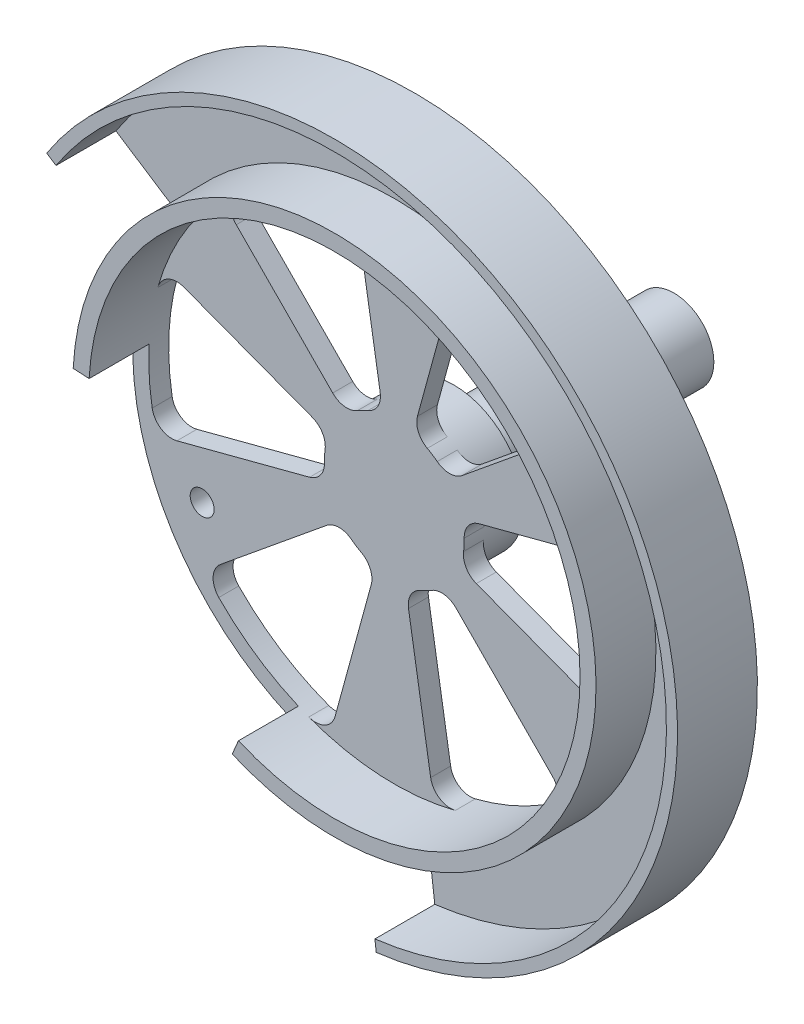
from build123d import *

# Parameters (mm, degrees)
SCHIZZO1_R                   = 10.000000000000002
ESTRUSIONE_ESTRUSIONE1_DEPTH = 55
SCHIZZO2_R                   = 17.500000000000004
ESTRUSIONE_ESTRUSIONE2_DEPTH = 10
SCHIZZO3_R                   = 85.905
ESTRUSIONE_ESTRUSIONE3_DEPTH = 5
ESTRUSIONE_ESTRUSIONE4_DEPTH = 15
TAGLIO_ESTRUSIONE1_DEPTH     = 141.2117614538809
ESTRUSIONE_ESTRUSIONE5_START = 15
SCHIZZO6_R                   = 65.50000000000003
SCHIZZO6_R_2                 = 61.50000000000001
ESTRUSIONE_ESTRUSIONE5_DEPTH = 15
TAGLIO_ESTRUSIONE2_DEPTH     = 141.2117614538809
TAGLIO_ESTRUSIONE3_DEPTH     = 15
SCHIZZO9_R                   = 3.0000000000000018
TAGLIO_ESTRUSIONE4_DEPTH     = 141.2117614538809


with BuildPart() as part:
    # Schizzo1 → Estrusione-Estrusione1 (new body)
    with BuildSketch(Plane.XY):
        Circle(SCHIZZO1_R)
    extrude(amount=ESTRUSIONE_ESTRUSIONE1_DEPTH)

    # Schizzo2 → Estrusione-Estrusione2 (add)
    with BuildSketch(Plane.XY.offset(55)):
        Circle(SCHIZZO2_R)
    extrude(amount=ESTRUSIONE_ESTRUSIONE2_DEPTH)

    # Schizzo3 → Estrusione-Estrusione3 (add)
    with BuildSketch(Plane.XY.offset(65)):
        Circle(SCHIZZO3_R)
    extrude(amount=ESTRUSIONE_ESTRUSIONE3_DEPTH)

    # Schizzo4 → Estrusione-Estrusione4 (add)
    with BuildSketch(Plane.XY.offset(70)):
        with BuildLine():
            ThreePointArc((2.33238e-12, 85.905), (-40.99032330010046, 75.49478406322679), (-72.04599513935142, 46.78721630296627))
            Line((-72.0459951393514, 46.78721630296625), (-69.71449096046315, 45.27311978562447))
            ThreePointArc((-69.71449096046314, 45.27311978562449), (-39.66382194658025, 73.05167249002571), (-1.12081e-12, 83.125))
            Line((0, 83.125), (0, 85.905))
        make_face()
        with BuildLine():
            Line((10.130389170552856, -82.5053988551849), (10.469185945219174, -85.26467715674777))
            ThreePointArc((10.469185945219136, -85.26467715674778), (64.3390411943792, -56.92237524197296), (85.905, -2.104e-14))
            ThreePointArc((85.905, 0), (60.74400803783119, 60.74400803782954), (2.33238e-12, 85.905))
            Line((0, 85.905), (0, 83.125))
            ThreePointArc((-1.10236e-12, 83.125), (58.77825118613137, 58.77825118613215), (83.125, 0))
            ThreePointArc((83.125, -2.036e-14), (62.25694429058578, -55.08029150793321), (10.130389170552828, -82.5053988551849))
        make_face()
    extrude(amount=ESTRUSIONE_ESTRUSIONE4_DEPTH)

    # Schizzo5 → Taglio-Estrusione1 (cut, through all)
    with BuildSketch(Plane.XY.offset(70)):
        with BuildLine():
            Line((-69.7144909604632, 45.27311978562441), (-72.04599513935146, 46.78721630296619))
            ThreePointArc((-72.04599513935142, 46.787216302966286), (-72.85157170031785, -45.522714393953365), (10.469185945219396, -85.26467715674775))
            Line((10.469185945218987, -85.26467715674781), (10.130389170552684, -82.50539885518494))
            Line((10.130389170552684, -82.50539885518494), (7.982441993037, -65.0117729325066))
            ThreePointArc((7.9824419930370025, -65.01177293250663), (-55.54715029824602, -34.70971180727477), (-54.932922200425146, 35.67385679348449))
            Line((-54.93292220042516, 35.67385679348449), (-69.7144909604632, 45.27311978562441))
        make_face()
    extrude(amount=-TAGLIO_ESTRUSIONE1_DEPTH, mode=Mode.SUBTRACT)

    # Schizzo6 → Estrusione-Estrusione5 (add)
    with BuildSketch(Plane.XY.offset(70).offset(ESTRUSIONE_ESTRUSIONE5_START)):
        Circle(SCHIZZO6_R)
        Circle(SCHIZZO6_R_2, mode=Mode.SUBTRACT)
    extrude(amount=-ESTRUSIONE_ESTRUSIONE5_DEPTH)

    # Schizzo7 → Taglio-Estrusione2 (cut, through all)
    with BuildSketch(Plane.XY.offset(70)):
        with BuildLine():
            Line((-9.094792559402517, 55.53858792138523), (-3.5451694376210634, 21.649059417410207))
            ThreePointArc((-3.5451694376210634, 21.649059417410207), (-4.118256573097941, 18.39563458554113), (-6.595126237509526, 16.209698020361557))
            ThreePointArc((-6.595126237509526, 16.209698020361557), (-7.944833745441985, 15.59261417329648), (-9.237403232743027, 14.863390646676436))
            ThreePointArc((-9.237403232743027, 14.863390646676436), (-12.461730523190647, 14.144422270775147), (-15.430658668606016, 15.59310017453149))
            Line((-15.430658668606016, 15.59310017453149), (-39.58587653291128, 40.00260465421101))
            ThreePointArc((-39.58587653291128, 40.00260465421101), (-41.025744459915046, 43.76718552220088), (-39.2205410364265, 47.37086827164967))
            ThreePointArc((-39.2205410364265, 47.37086827164967), (-27.92041573398183, 54.796901237584784), (-15.27058186191767, 59.57398198541434))
            ThreePointArc((-15.27058186191767, 59.57398198541434), (-11.294069325563324, 58.91623065925357), (-9.094792559402517, 55.53858792138523))
        make_face()
        with BuildLine():
            Line((43.550431750534024, 35.64561535928479), (16.976050704705482, 13.894736502405099))
            ThreePointArc((16.976050704705482, 13.894736502405099), (13.871958583265304, 12.764332104375594), (10.740447154552704, 13.816395873029286))
            ThreePointArc((10.740447154552704, 13.816395873029286), (9.53118311276309, 14.676734939044845), (8.253372270022329, 15.431521187894159))
            ThreePointArc((8.253372270022329, 15.431521187894159), (6.018563746750371, 17.864386343586606), (5.788691540596875, 21.159892491405103))
            Line((5.788691540596875, 21.159892491405103), (14.850333581636846, 54.28367703568089))
            ThreePointArc((14.850333581636846, 54.28367703568089), (17.390622284415066, 57.41292967255552), (21.41410480436174, 57.65141902354019))
            ThreePointArc((21.41410480436174, 57.65141902354019), (33.495300653424565, 51.578239928643306), (43.95729087300659, 43.011702815697646))
            ThreePointArc((43.95729087300659, 43.011702815697646), (45.37591778335563, 39.239066277667106), (43.550431750534024, 35.64561535928479))
        make_face()
        with BuildLine():
            Line((52.645224309936374, -19.89297256210059), (20.52122014232648, -7.754322915005166))
            ThreePointArc((20.52122014232648, -7.754322915005166), (17.990215156363192, -5.631302481165585), (17.335573392062187, -2.3933021473323244))
            ThreePointArc((17.335573392062187, -2.3933021473323244), (17.476016858205035, -0.9158792342516949), (17.49077550276533, 0.5681305412176627))
            ThreePointArc((17.49077550276533, 0.5681305412176627), (18.480294269940998, 3.7199640728113863), (21.21935020920287, 5.566792316873533))
            Line((21.21935020920287, 5.566792316873533), (54.436210114548075, 14.281072381469665))
            ThreePointArc((54.436210114548075, 14.281072381469665), (58.416366744330055, 13.64574415035441), (60.634645840788174, 10.280550751890294))
            ThreePointArc((60.634645840788174, 10.280550751890294), (61.41571638740626, -3.2186613089416714), (59.2278727349241, -16.562279169716877))
            ThreePointArc((59.2278727349241, -16.562279169716877), (56.66998710891878, -19.67716438158663), (52.645224309936374, -19.89297256210059))
        make_face()
        with BuildLine():
            Line((9.094792559402126, -55.538587921385286), (3.54516943762091, -21.649059417410225))
            ThreePointArc((3.54516943762091, -21.649059417410225), (4.118256573097811, -18.395634585541153), (6.595126237509411, -16.209698020361596))
            ThreePointArc((6.595126237509411, -16.209698020361596), (7.944833745441873, -15.592614173296528), (9.237403232742922, -14.863390646676493))
            ThreePointArc((9.237403232742922, -14.863390646676493), (12.461730523190546, -14.144422270775227), (15.430658668605904, -15.593100174531589))
            Line((15.430658668605904, -15.593100174531589), (39.585876532911, -40.00260465421129))
            ThreePointArc((39.585876532911, -40.00260465421129), (41.02574445991474, -43.76718552220117), (39.22054103642617, -47.37086827164993))
            ThreePointArc((39.22054103642617, -47.37086827164993), (27.92041573398144, -54.79690123758496), (15.27058186191725, -59.57398198541444))
            ThreePointArc((15.27058186191725, -59.57398198541444), (11.29406932556291, -58.91623065925364), (9.094792559402126, -55.538587921385286))
        make_face()
        with BuildLine():
            Line((-43.55043175053426, -35.645615359284484), (-16.976050704705578, -13.89473650240498))
            ThreePointArc((-16.976050704705578, -13.89473650240498), (-13.87195858326539, -12.764332104375498), (-10.740447154552799, -13.816395873029213))
            ThreePointArc((-10.740447154552799, -13.816395873029213), (-9.53118311276319, -14.676734939044781), (-8.253372270022437, -15.4315211878941))
            ThreePointArc((-8.253372270022437, -15.4315211878941), (-6.018563746750495, -17.86438634358656), (-5.7886915405970205, -21.159892491405063))
            Line((-5.7886915405970205, -21.159892491405063), (-14.850333581637225, -54.283677035680796))
            ThreePointArc((-14.850333581637225, -54.283677035680796), (-17.39062228441547, -57.41292967255541), (-21.414104804362143, -57.65141902354005))
            ThreePointArc((-21.414104804362143, -57.65141902354005), (-33.49530065342495, -51.57823992864311), (-43.9572908730069, -43.01170281569734))
            ThreePointArc((-43.9572908730069, -43.01170281569734), (-45.375917783355895, -39.23906627766678), (-43.55043175053426, -35.645615359284484))
        make_face()
        with BuildLine():
            Line((-52.64522430993622, 19.892972562100955), (-20.52122014232642, 7.754322915005307))
            ThreePointArc((-20.52122014232642, 7.754322915005307), (-17.990215156363146, 5.631302481165709), (-17.335573392062166, 2.393302147332444))
            ThreePointArc((-17.335573392062166, 2.393302147332444), (-17.47601685820502, 0.915879234251819), (-17.49077550276533, -0.5681305412175421))
            ThreePointArc((-17.49077550276533, -0.5681305412175421), (-18.480294269941023, -3.7199640728112584), (-21.219350209202908, -5.566792316873385))
            Line((-21.219350209202908, -5.566792316873385), (-54.43621011454816, -14.281072381469283))
            ThreePointArc((-54.43621011454816, -14.281072381469283), (-58.41636674433013, -13.645744150354004), (-60.63464584078823, -10.280550751889873))
            ThreePointArc((-60.63464584078823, -10.280550751889873), (-61.41571638740626, 3.218661308942107), (-59.22787273492397, 16.562279169717286))
            ThreePointArc((-59.22787273492397, 16.562279169717286), (-56.66998710891863, 19.677164381587026), (-52.64522430993622, 19.892972562100955))
        make_face()
    extrude(amount=-TAGLIO_ESTRUSIONE2_DEPTH, mode=Mode.SUBTRACT)

    # Schizzo8 → Taglio-Estrusione3 (cut)
    with BuildSketch(Plane.XY.offset(85)):
        with BuildLine():
            Line((-65.41023452642462, 3.4280051339130924), (-61.41571638740627, 3.2186613089413))
            ThreePointArc((-61.41571638740627, 3.2186613089413), (-52.15495791361932, -32.590034750342085), (-24.029964402089327, -56.61104848732551))
            Line((-24.029964402089327, -56.61104848732551), (-25.592888916046377, -60.29306790113534))
            ThreePointArc((-25.592888916046377, -60.29306790113534), (-55.547150298245406, -34.709711807275156), (-65.41023452642462, 3.4280051339130924))
        make_face()
    extrude(amount=-TAGLIO_ESTRUSIONE3_DEPTH, mode=Mode.SUBTRACT)

    # Schizzo9 → Taglio-Estrusione4 (cut, through all)
    with BuildSketch(Plane.XY.offset(70)):
        with Locations((-48.11604392732846, -24.512166709277214)):
            Circle(SCHIZZO9_R)
    extrude(amount=-TAGLIO_ESTRUSIONE4_DEPTH, mode=Mode.SUBTRACT)


solid = part.part
